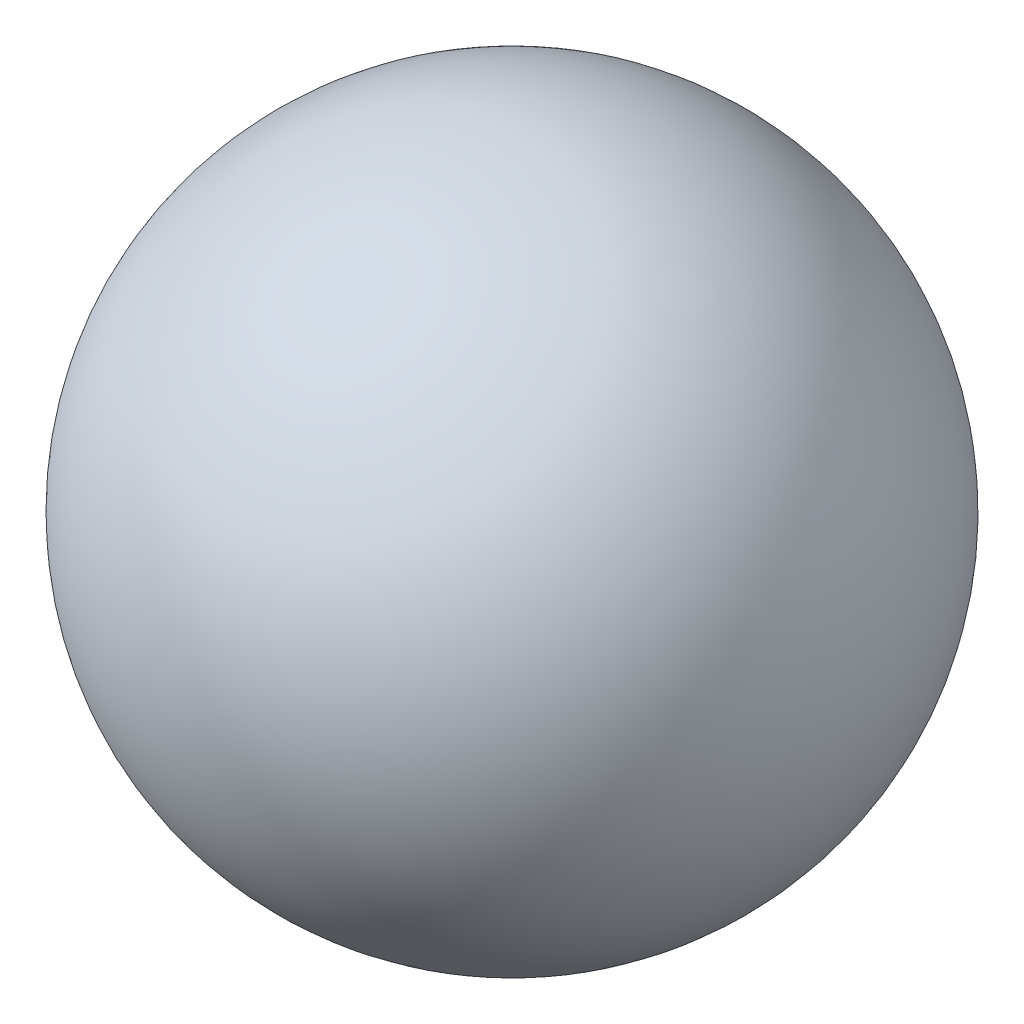
from build123d import *

# Parameters (mm, degrees)
SKETCH2_R          = 6.35
CUT_EXTRUDE1_DEPTH = 19.05


with BuildPart() as part:
    # Sketch1 → Revolve1 (revolve)
    with BuildSketch(Plane.XY):
        with BuildLine():
            Line((0, 38.1), (0, 0))
            ThreePointArc((0, 0), (19.05, 19.05), (0, 38.1))
        make_face()
    revolve(axis=Axis((0, 49.026792453, 0), (0, -1, 0)))

    # Sketch2 → Cut-Extrude1 (cut)
    with BuildSketch(Plane(origin=(0, 0, 0), x_dir=(1, 0, 0), z_dir=(0, 1, 0))):
        with Locations(Location((0, 0, 0), (0, 0, 90))):
            Circle(SKETCH2_R)
    extrude(amount=CUT_EXTRUDE1_DEPTH, mode=Mode.SUBTRACT)


solid = part.part
